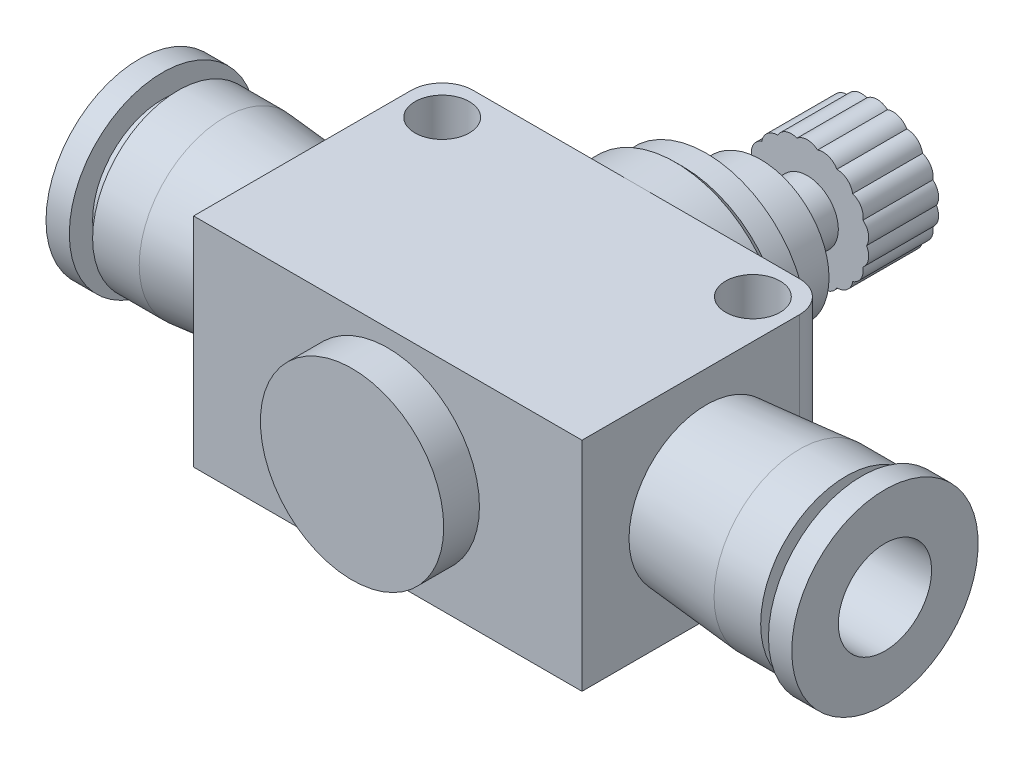
from build123d import *

# Parameters (mm, degrees)
SKETCH_1_W               = 25
SKETCH_1_H               = 16
EXTRUDE_1_DEPTH          = 7
SKETCH_3_W               = 5.9
SKETCH_3_H               = 2.3
FILLET_1_R               = 2
SKETCH_4_R               = 1.75
CUT_EXTRUDE_1_DEPTH      = 37.390245946
CUT_EXTRUDE_2_DEPTH      = 4.5
PATTERN_CIRCULAR_1_COUNT = 18


with BuildPart() as part:
    # 草图1 → 凸台-拉伸1 (new, symmetric)
    with BuildSketch(Plane(origin=(0, 0, 0), x_dir=(1, 0, 0), z_dir=(0, 1, 0))):
        Rectangle(SKETCH_1_W, SKETCH_1_H)
    extrude(amount=EXTRUDE_1_DEPTH, both=True)

    # 草图2 → 旋转1 (revolve)
    with BuildSketch(Plane(origin=(0, 0, 0), x_dir=(1, 0, 0), z_dir=(0, 1, 0)), mode=Mode.PRIVATE) as revolve_1_sk:
        Polygon((-12.5, 4.975068019), (-18.5, 5.5), (-21.5, 5.5), (-21.5, 4.5), (-22.5, 4.5), (-22.5, 6), (-24, 6), (-24, 3), (-19.5, 3), (-19.5, 2), (-12.5, 2), align=None)
        Polygon((19.5, 2), (12.5, 2), (12.5, 4.975068019), (18.5, 5.5), (21.5, 5.5), (21.5, 4.5), (22.5, 4.5), (22.5, 6), (24, 6), (24, 3), (19.5, 3), align=None)
    revolve(revolve_1_sk.sketch.rotate(Axis((-27.060600163, 0, 0), (1, 0, 0)), 180), axis=Axis((-27.060600163, 0, 0), (1, 0, 0)))

    # 草图3 → 旋转2 (revolve)
    with BuildSketch(Plane(origin=(0, 0, 0), x_dir=(1, 0, 0), z_dir=(0, 1, 0))):
        Polygon((7, 8), (7, 10.5), (6.5, 11), (6.5, 12.5), (4, 12.5), (4, 13.5), (4.4, 13.5), (4.4, 16), (2, 16), (2, 19), (4, 19), (4, 23.5), (0, 23.5), (0, 8), align=None)
        with Locations((2.95, -9.15)):
            Rectangle(SKETCH_3_W, SKETCH_3_H)
    revolve(axis=Axis((0, 0, 30.021655922), (0, 0, -1)))

    # 圆角1
    fillet_1_edges = [part.edges().sort_by_distance(p)[0] for p in [
        (-12.5, 0, -8),
        (12.5, 0, -8),
    ]]
    fillet(fillet_1_edges, radius=FILLET_1_R)

    # 草图4 → 切除-拉伸1 (cut, through all)
    with BuildSketch(Plane(origin=(0, 7, 0), x_dir=(1, 0, 0), z_dir=(0, 1, 0))):
        with Locations(Location((-10, 5.5, 0), (0, 0, 270))):
            Circle(SKETCH_4_R)
        with Locations(Location((10, 5.5, 0), (0, 0, 270))):
            Circle(SKETCH_4_R)
    extrude(amount=-CUT_EXTRUDE_1_DEPTH, mode=Mode.SUBTRACT)

    # 草图5 → 切除-拉伸2 (cut)
    with BuildSketch(Plane(origin=(0, 0, -23.5), x_dir=(-1, 0, 0), z_dir=(0, 0, -1))):
        with BuildLine():
            ThreePointArc((0, 4), (0.352895639, 3.937075737), (0.662294506, 3.756058788))
            ThreePointArc((0.662294506, 3.756058788), (1.01494578, 3.820338434), (1.368080573, 3.758770483))
            ThreePointArc((1.368080573, 3.758770483), (0.694592711, 3.939231012), (0, 4))
        make_face()
    cut_extrude_2 = extrude(amount=-CUT_EXTRUDE_2_DEPTH, mode=Mode.SUBTRACT)

    # 阵列(圆周)1: 切除-拉伸2 ×18 about axis
    pattern_circular_1_axis = Axis((0, 0, 0), (0, 0, 1))
    for i in range(1, PATTERN_CIRCULAR_1_COUNT):
        add(cut_extrude_2.rotate(pattern_circular_1_axis, i * 360 / PATTERN_CIRCULAR_1_COUNT), mode=Mode.SUBTRACT)


solid = part.part
